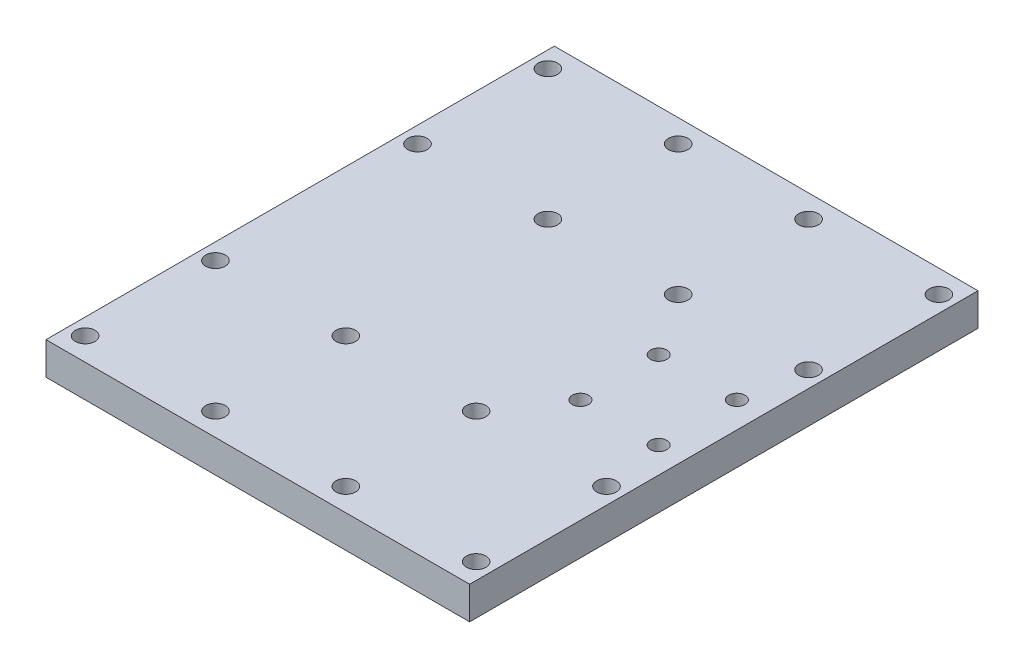
from build123d import *

# Parameters (mm, degrees)
SKETCH1_W            = 130
SKETCH1_H            = 156
SKETCH1_R            = 3
BOSS_EXTRUDE1_DEPTH  = 10
SKETCH2_R            = 2.5
CUT_EXTRUDE1_DEPTH   = 10
SKETCH3_W            = 130
SKETCH3_H            = 10
BOSS_EXTRUDE2_DEPTH  = 10
SKETCH4_W            = 130
SKETCH4_H            = 10
BOSS_EXTRUDE3_DEPTH  = 10
SKETCH5_W            = 130
SKETCH5_H            = 10
CUT_EXTRUDE2_DEPTH   = 12.25
SKETCH6_W            = 130
SKETCH6_H            = 12.25
CUT_EXTRUDE3_DEPTH   = 20
SKETCH7_W            = 130
SKETCH7_H            = 10
BOSS_EXTRUDE5_DEPTH  = 2.25
SKETCH8_W            = 130
SKETCH8_H            = 10
BOSS_EXTRUDE6_DEPTH  = 2.25
SKETCH10_W           = 130
SKETCH10_H           = 10
BOSS_EXTRUDE8_DEPTH  = 10
SKETCH11_W           = 130
SKETCH11_H           = 10
BOSS_EXTRUDE10_DEPTH = 7
SKETCH12_W           = 130
SKETCH12_H           = 10
CUT_EXTRUDE4_DEPTH   = 7
SKETCH14_W           = 130
SKETCH14_H           = 10
CUT_EXTRUDE5_DEPTH   = 10


with BuildPart() as part:
    # Sketch1 → Boss-Extrude1 (new body)
    with BuildSketch(Plane(origin=(0, 0, 0), x_dir=(1, 0, 0), z_dir=(0, 1, 0))):
        with Locations((65, -43.506875339)):
            Rectangle(SKETCH1_W, SKETCH1_H)
        with Locations(Location((5, 27.493124661, 0), (0, 0, 270))):
            Circle(SKETCH1_R, mode=Mode.SUBTRACT)
        with Locations(Location((45, 27.493124661, 0), (0, 0, 270))):
            Circle(SKETCH1_R, mode=Mode.SUBTRACT)
        with Locations(Location((45, -12.506875339, 0), (0, 0, 270))):
            Circle(SKETCH1_R, mode=Mode.SUBTRACT)
        with Locations(Location((5, -12.506875339, 0), (0, 0, 270))):
            Circle(SKETCH1_R, mode=Mode.SUBTRACT)
        with Locations(Location((85, 27.493124661, 0), (0, 0, 270))):
            Circle(SKETCH1_R, mode=Mode.SUBTRACT)
        with Locations(Location((125, 27.493124661, 0), (0, 0, 270))):
            Circle(SKETCH1_R, mode=Mode.SUBTRACT)
        with Locations(Location((85, -12.506875339, 0), (0, 0, 270))):
            Circle(SKETCH1_R, mode=Mode.SUBTRACT)
        with Locations(Location((125, -12.506875339, 0), (0, 0, 270))):
            Circle(SKETCH1_R, mode=Mode.SUBTRACT)
        with Locations(Location((85, -74.506875339, 0), (0, 0, 270))):
            Circle(SKETCH1_R, mode=Mode.SUBTRACT)
        with Locations(Location((125, -74.506875339, 0), (0, 0, 270))):
            Circle(SKETCH1_R, mode=Mode.SUBTRACT)
        with Locations(Location((125, -114.506875339, 0), (0, 0, 270))):
            Circle(SKETCH1_R, mode=Mode.SUBTRACT)
        with Locations(Location((85, -114.506875339, 0), (0, 0, 270))):
            Circle(SKETCH1_R, mode=Mode.SUBTRACT)
        with Locations(Location((5, -74.506875339, 0), (0, 0, 270))):
            Circle(SKETCH1_R, mode=Mode.SUBTRACT)
        with Locations(Location((45, -74.506875339, 0), (0, 0, 270))):
            Circle(SKETCH1_R, mode=Mode.SUBTRACT)
        with Locations(Location((5, -114.506875339, 0), (0, 0, 270))):
            Circle(SKETCH1_R, mode=Mode.SUBTRACT)
        with Locations(Location((45, -114.506875339, 0), (0, 0, 270))):
            Circle(SKETCH1_R, mode=Mode.SUBTRACT)
    extrude(amount=BOSS_EXTRUDE1_DEPTH)

    # Sketch2 → Cut-Extrude1 (cut)
    with BuildSketch(Plane(origin=(0, 10, 0), x_dir=(1, 0, 0), z_dir=(0, 1, 0))):
        with Locations(Location((98, -31.506875339, 0), (0, 0, 270))):
            Circle(SKETCH2_R)
        with Locations(Location((98, -55.506875339, 0), (0, 0, 270))):
            Circle(SKETCH2_R)
        with Locations(Location((122, -55.506875339, 0), (0, 0, 270))):
            Circle(SKETCH2_R)
        with Locations(Location((122, -31.506875339, 0), (0, 0, 270))):
            Circle(SKETCH2_R)
    extrude(amount=-CUT_EXTRUDE1_DEPTH, mode=Mode.SUBTRACT)

    # Sketch3 → Boss-Extrude2 (add)
    with BuildSketch(Plane(origin=(0, 0, -34.493124661), x_dir=(-1, 0, 0), z_dir=(0, 0, -1))):
        with Locations((-65, 5)):
            Rectangle(SKETCH3_W, SKETCH3_H)
    extrude(amount=BOSS_EXTRUDE2_DEPTH)

    # Sketch4 → Boss-Extrude3 (add)
    with BuildSketch(Plane.XY.offset(121.506875339)):
        with Locations((65, 5)):
            Rectangle(SKETCH4_W, SKETCH4_H)
    extrude(amount=BOSS_EXTRUDE3_DEPTH)

    # Sketch5 → Cut-Extrude2 (cut)
    with BuildSketch(Plane.XY.offset(131.506875339)):
        with Locations((65, 5)):
            Rectangle(SKETCH5_W, SKETCH5_H)
    extrude(amount=-CUT_EXTRUDE2_DEPTH, mode=Mode.SUBTRACT)

    # Sketch6 → Cut-Extrude3 (cut)
    with BuildSketch(Plane(origin=(0, 10, 0), x_dir=(1, 0, 0), z_dir=(0, 1, 0))):
        with Locations((65, 38.368124661)):
            Rectangle(SKETCH6_W, SKETCH6_H)
    extrude(amount=-CUT_EXTRUDE3_DEPTH, mode=Mode.SUBTRACT)

    # Sketch7 → Boss-Extrude5 (add)
    with BuildSketch(Plane(origin=(0, 0, -32.243124661), x_dir=(-1, 0, 0), z_dir=(0, 0, -1))):
        with Locations((-65, 5)):
            Rectangle(SKETCH7_W, SKETCH7_H)
    extrude(amount=BOSS_EXTRUDE5_DEPTH)

    # Sketch8 → Boss-Extrude6 (add)
    with BuildSketch(Plane.XY.offset(119.256875339)):
        with Locations((65, 5)):
            Rectangle(SKETCH8_W, SKETCH8_H)
    extrude(amount=BOSS_EXTRUDE6_DEPTH)

    # Sketch10 → Boss-Extrude8 (add)
    with BuildSketch(Plane.XY.offset(121.506875339)):
        with Locations((65, 5)):
            Rectangle(SKETCH10_W, SKETCH10_H)
    extrude(amount=BOSS_EXTRUDE8_DEPTH)

    # Sketch11 → Boss-Extrude10 (add)
    with BuildSketch(Plane(origin=(0, 0, -34.493124661), x_dir=(-1, 0, 0), z_dir=(0, 0, -1))):
        with Locations((-65, 5)):
            Rectangle(SKETCH11_W, SKETCH11_H)
    extrude(amount=BOSS_EXTRUDE10_DEPTH)

    # Sketch12 → Cut-Extrude4 (cut)
    with BuildSketch(Plane(origin=(0, 0, -41.493124661), x_dir=(-1, 0, 0), z_dir=(0, 0, -1))):
        with Locations((-65, 5)):
            Rectangle(SKETCH12_W, SKETCH12_H)
    extrude(amount=-CUT_EXTRUDE4_DEPTH, mode=Mode.SUBTRACT)

    # Sketch14 → Cut-Extrude5 (cut)
    with BuildSketch(Plane.XY.offset(131.506875339)):
        with Locations((65, 5)):
            Rectangle(SKETCH14_W, SKETCH14_H)
    extrude(amount=-CUT_EXTRUDE5_DEPTH, mode=Mode.SUBTRACT)


solid = part.part
